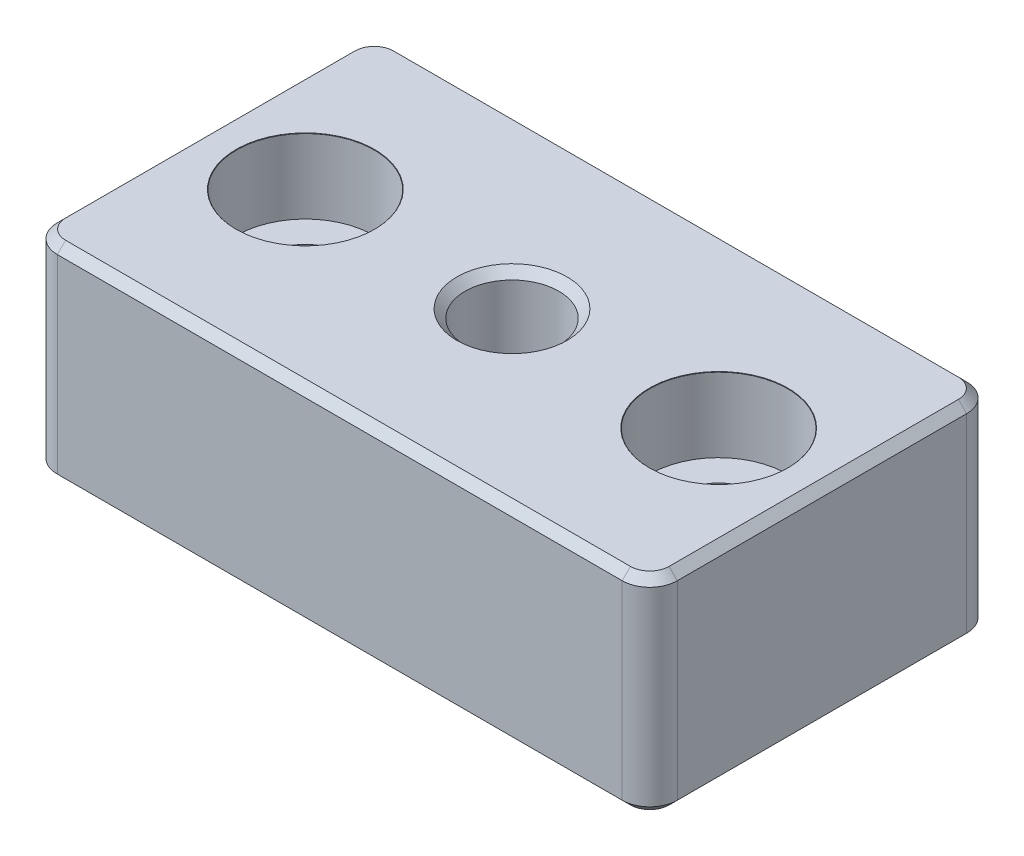
from build123d import *

# Parameters (mm, degrees)
SKETCH1_W                                    = 45
SKETCH1_H                                    = 25
BOSS_EXTRUDE1_DEPTH                          = 15
HOLE1_D                                      = 6.8
HOLE1_DEPTH                                  = 10
CBORE_FOR_M5_HEX_SOCKET_HEAD_CAP_SCR_2_COUNT = 2
CBORE_FOR_M5_HEX_SOCKET_HEAD_CAP_SCR_2_PITCH = 30
FILLET1_R                                    = 2
CHAMFER1_SIZE                                = 0.6


with BuildPart() as part:
    # Sketch1 → Boss-Extrude1 (new body)
    with BuildSketch(Plane(origin=(0, 0, 0), x_dir=(1, 0, 0), z_dir=(0, 1, 0))):
        Rectangle(SKETCH1_W, SKETCH1_H)
    extrude(amount=BOSS_EXTRUDE1_DEPTH)

    # Hole1
    with Locations(Plane(origin=(0, 15, 0), x_dir=(1, 0, 0), z_dir=(0, 1, 0))):
        with Locations((0, 0)):
            Hole(HOLE1_D / 2, depth=HOLE1_DEPTH)

    # Sketch7 → CBORE for M5 Hex Socket Head Cap Screw1 (revolve, cut)
    with BuildSketch(Plane(origin=(15, 15, 0), x_dir=(0, 0, 1), z_dir=(1, 0, 0))):
        Polygon((0, 0), (0, 15), (2.75, 15), (2.75, 5.4), (5, 5.4), (5, 0.025), (5.025, 0), align=None)
    cbore_for_m5_hex_socket_head_cap_screw1 = revolve(axis=Axis((15, 21.35, 0), (0, -1, 0)), mode=Mode.SUBTRACT)

    # CBORE for M5 Hex Socket Head Cap Scr 2: CBORE for M5 Hex Socket Head Cap Screw1 ×2
    with Locations(*[(-i * CBORE_FOR_M5_HEX_SOCKET_HEAD_CAP_SCR_2_PITCH, 0, 0) for i in range(1, CBORE_FOR_M5_HEX_SOCKET_HEAD_CAP_SCR_2_COUNT)]):
        add(cbore_for_m5_hex_socket_head_cap_screw1, mode=Mode.SUBTRACT)

    # Fillet1
    fillet1_edges = [part.edges().sort_by_distance(p)[0] for p in [
        (-22.5, 7.5, -12.5),
        (22.5, 7.5, -12.5),
        (22.5, 7.5, 12.5),
        (-22.5, 7.5, 12.5),
    ]]
    fillet(fillet1_edges, radius=FILLET1_R)

    # Chamfer1
    chamfer1_edges = [part.edges().sort_by_distance(p)[0] for p in [
        (3.4, 15, 0),
        (15, 0, -2.75),
        (-15, 0, -2.75),
        (-22.5, 0, 0),
        (-22.5, 15, 0),
        (0, 0, -12.5),
        (22.5, 0, 0),
        (0, 0, 12.5),
        (21.914213562, 0, 11.914213562),
        (21.914213562, 0, -11.914213562),
        (-21.914213562, 0, 11.914213562),
        (-21.914213562, 0, -11.914213562),
        (0, 15, -12.5),
        (0, 15, 12.5),
        (22.5, 15, 0),
        (21.914213562, 15, 11.914213562),
        (21.914213562, 15, -11.914213562),
        (-21.914213562, 15, 11.914213562),
        (-21.914213562, 15, -11.914213562),
    ]]
    chamfer(chamfer1_edges, length=CHAMFER1_SIZE)


solid = part.part
